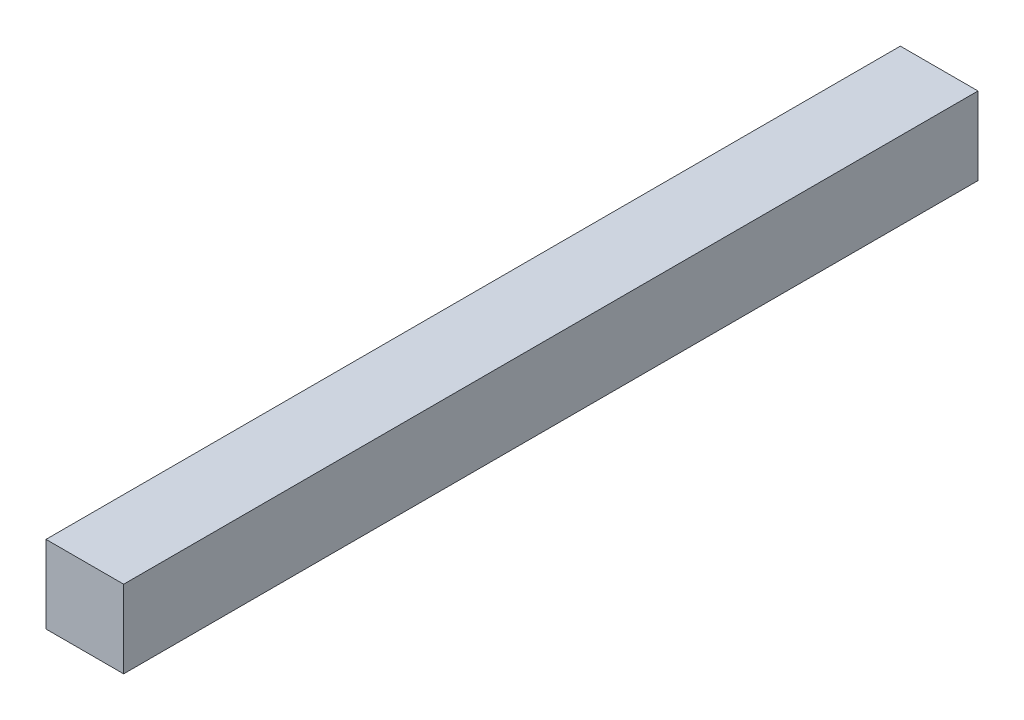
from build123d import *

# Parameters (mm, degrees)
SKETCH1_W           = 2.54
SKETCH1_H           = 2.54
BOSS_EXTRUDE1_DEPTH = 27.94


with BuildPart() as part:
    # Sketch1 → Boss-Extrude1 (new body)
    with BuildSketch(Plane.XY):
        with Locations((-1.27, 1.27)):
            Rectangle(SKETCH1_W, SKETCH1_H)
    extrude(amount=BOSS_EXTRUDE1_DEPTH)


solid = part.part
